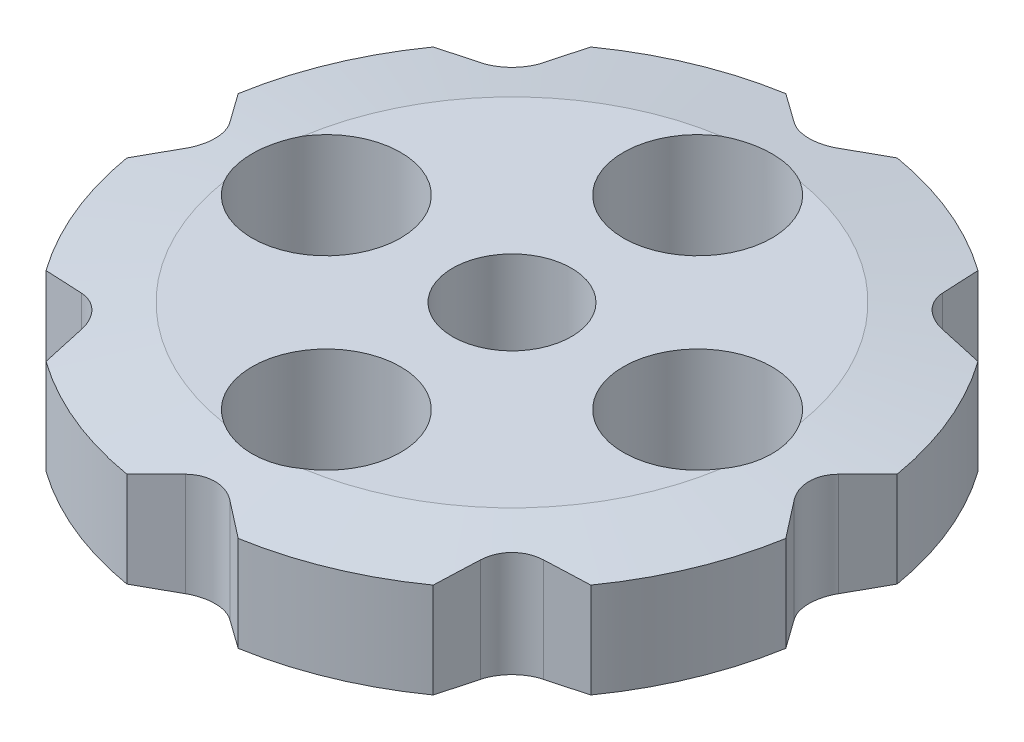
from build123d import *

# Parameters (mm, degrees)
SKETCH_1_R               = 9
EXTRUDE_1_DEPTH          = 3.2
CUT_EXTRUDE_2_REACH      = 15.124
PATTERN_CIRCULAR_1_COUNT = 8
CUT_EXTRUDE_1_REACH      = 14.951
SKETCH_3_R               = 2
PATTERN_CIRCULAR_2_COUNT = 4
CUT_EXTRUDE_3_REACH      = 14.951
SKETCH_6_R               = 1.6


with BuildPart() as part:
    # 草图1 → 凸台-拉伸1 (new body)
    with BuildSketch(Plane(origin=(0, 0, 0), x_dir=(1, 0, 0), z_dir=(0, 1, 0))):
        with Locations(Location((0, 0, 0), (0, 0, 270))):
            Circle(SKETCH_1_R)
        with BuildLine():
            Line((-1.058300524, 1.2), (1.058300524, 1.2))
            ThreePointArc((1.058300524, 1.2), (0, -1.6), (-1.058300524, 1.2))
        make_face(mode=Mode.SUBTRACT)
    extrude(amount=EXTRUDE_1_DEPTH)

    # 草图4 → 切除-拉伸2 (cut, up to next)
    with BuildSketch(Plane(origin=(0, 3.2, 0), x_dir=(1, 0, 0), z_dir=(0, 1, 0)), mode=Mode.PRIVATE) as cut_extrude_2_sk1:
        with BuildLine():
            Line((-1.5, 8.874119675), (-0.599498979, 8.19962448))
            ThreePointArc((-0.599498979, 8.19962448), (0, 8), (0.599498979, 8.19962448))
            Line((0.599498979, 8.19962448), (1.5, 8.874119675))
            ThreePointArc((1.5, 8.874119675), (0, 9), (-1.5, 8.874119675))
        make_face()
    cut_extrude_2_tool1 = extrude(cut_extrude_2_sk1.sketch, amount=-CUT_EXTRUDE_2_REACH, mode=Mode.PRIVATE) & part.part
    cut_extrude_2 = cut_extrude_2_tool1.solids().sort_by_distance((0, 3.2, -8.590322))[0]
    add(cut_extrude_2, mode=Mode.SUBTRACT)

    # 阵列(圆周)1: 切除-拉伸2 ×8 about axis
    pattern_circular_1_axis = Axis((0, 0, 0), (0, 1, 0))
    for i in range(1, PATTERN_CIRCULAR_1_COUNT):
        add(cut_extrude_2.rotate(pattern_circular_1_axis, i * 360 / PATTERN_CIRCULAR_1_COUNT), mode=Mode.SUBTRACT)

    # 草图3 → 切除-拉伸1 (cut, up to next)
    with BuildSketch(Plane(origin=(0, 3.2, 0), x_dir=(1, 0, 0), z_dir=(0, 1, 0)), mode=Mode.PRIVATE) as cut_extrude_1_sk1:
        with Locations(Location((0, 5, 0), (0, 0, 270))):
            Circle(SKETCH_3_R)
    cut_extrude_1_tool1 = extrude(cut_extrude_1_sk1.sketch, amount=-CUT_EXTRUDE_1_REACH, mode=Mode.PRIVATE) & part.part
    cut_extrude_1 = cut_extrude_1_tool1.solids().sort_by_distance((0, 3.2, -5))[0]
    add(cut_extrude_1, mode=Mode.SUBTRACT)

    # 阵列(圆周)2: 切除-拉伸1 ×4 about axis
    pattern_circular_2_axis = Axis((0, 0, 0), (0, 1, 0))
    for i in range(1, PATTERN_CIRCULAR_2_COUNT):
        add(cut_extrude_1.rotate(pattern_circular_2_axis, i * 360 / PATTERN_CIRCULAR_2_COUNT), mode=Mode.SUBTRACT)

    # 草图5 → 切除-旋转1 (revolve, cut)
    with BuildSketch(Plane(origin=(0, 0, 0), x_dir=(0, 0, -1), z_dir=(1, 0, 0)), mode=Mode.PRIVATE) as cut_revolve_1_sk:
        Polygon((9.374119675, 2.82841307), (6.778765119, 3.2), (9.374119675, 3.2), align=None)
    cut_revolve_1 = revolve(cut_revolve_1_sk.sketch.rotate(Axis((0, 3.2, 0), (0, -1, 0)), 4.181624795), axis=Axis((0, 3.2, 0), (0, -1, 0)), mode=Mode.SUBTRACT)

    # 镜向1: 切除-旋转1 across plane
    add(cut_revolve_1.mirror(Plane.ZX.offset(1.6)), mode=Mode.SUBTRACT)

    # 草图6 → 切除-拉伸3 (cut, up to next)
    with BuildSketch(Plane(origin=(0, 3.2, 0), x_dir=(1, 0, 0), z_dir=(0, 1, 0)), mode=Mode.PRIVATE) as cut_extrude_3_sk1:
        with Locations(Location((0, 0, 0), (0, 0, 270))):
            Circle(SKETCH_6_R)
    cut_extrude_3_tool1 = extrude(cut_extrude_3_sk1.sketch, amount=-CUT_EXTRUDE_3_REACH, mode=Mode.PRIVATE) & part.part
    add(cut_extrude_3_tool1.solids().sort_by_distance((0, 3.2, 0))[0], mode=Mode.SUBTRACT)


solid = part.part
